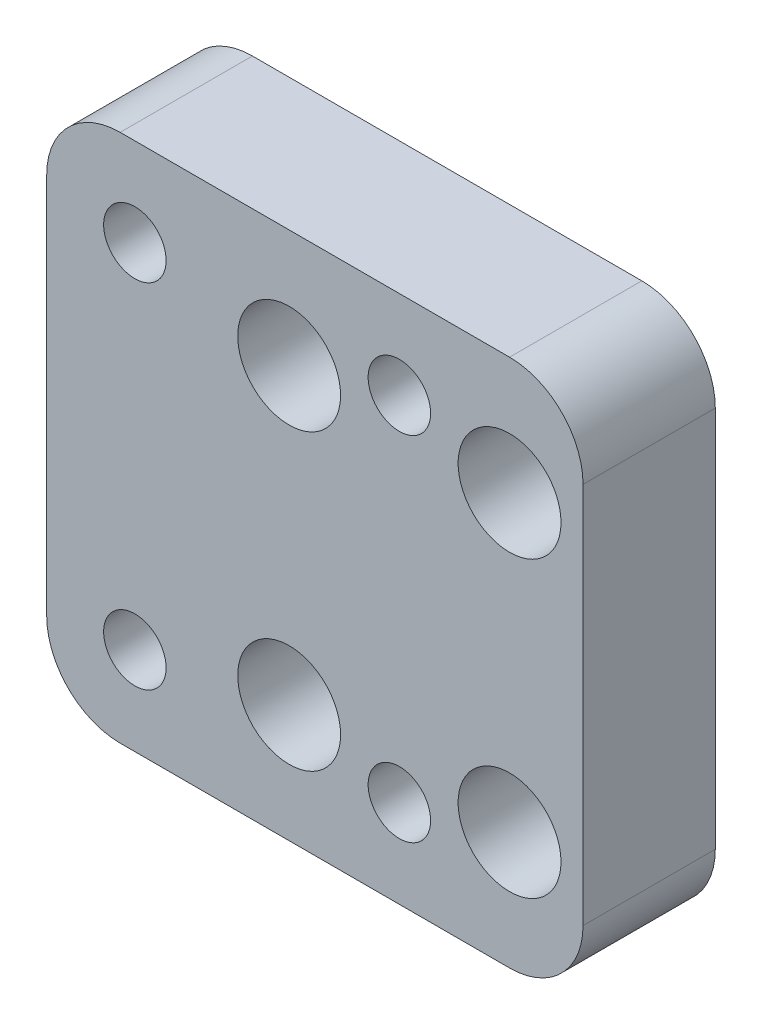
from build123d import *

# Parameters (mm, degrees)
SKETCH1_W           = 36.5
SKETCH1_H           = 36
SKETCH1_R           = 1.625
SKETCH1_R_2         = 2.125
BOSS_EXTRUDE1_DEPTH = 9
SKETCH2_R           = 3.5
CUT_EXTRUDE1_DEPTH  = 5
CUT_EXTRUDE2_DEPTH  = 5
FILLET2_R           = 5


with BuildPart() as part:
    # Sketch1 → Boss-Extrude1 (new body)
    with BuildSketch(Plane.XY):
        with Locations((1.75, 10)):
            Rectangle(SKETCH1_W, SKETCH1_H)
        with Locations((0, 20)):
            Circle(SKETCH1_R, mode=Mode.SUBTRACT)
        with Locations((15, 20)):
            Circle(SKETCH1_R, mode=Mode.SUBTRACT)
        with Locations((15, 0)):
            Circle(SKETCH1_R, mode=Mode.SUBTRACT)
        Circle(SKETCH1_R, mode=Mode.SUBTRACT)
        with Locations((-10.5, 22)):
            Circle(SKETCH1_R_2, mode=Mode.SUBTRACT)
        with Locations((7.5, 22)):
            Circle(SKETCH1_R_2, mode=Mode.SUBTRACT)
        with Locations((7.5, -2)):
            Circle(SKETCH1_R_2, mode=Mode.SUBTRACT)
        with Locations((-10.5, -2)):
            Circle(SKETCH1_R_2, mode=Mode.SUBTRACT)
    extrude(amount=BOSS_EXTRUDE1_DEPTH)

    # Sketch2 → Cut-Extrude1 (cut)
    with BuildSketch(Plane.XY.offset(9)):
        with Locations((0, 20)):
            Circle(SKETCH2_R)
        Circle(SKETCH2_R)
        with Locations((15, 0)):
            Circle(SKETCH2_R)
        with Locations((15, 20)):
            Circle(SKETCH2_R)
    extrude(amount=-CUT_EXTRUDE1_DEPTH, mode=Mode.SUBTRACT)

    # Sketch3 → Cut-Extrude2 (cut)
    with BuildSketch(Plane(origin=(0, 0, 0), x_dir=(-1, 0, 0), z_dir=(0, 0, -1))):
        Polygon((-5.334936491, 18.25), (-3.169872981, 22), (-5.334936491, 25.75), (-9.665063509, 25.75), (-11.830127019, 22), (-9.665063509, 18.25), align=None)
        Polygon((12.665063509, 18.25), (14.830127019, 22), (12.665063509, 25.75), (8.334936491, 25.75), (6.169872981, 22), (8.334936491, 18.25), align=None)
        Polygon((12.665063509, -5.75), (14.830127019, -2), (12.665063509, 1.75), (8.334936491, 1.75), (6.169872981, -2), (8.334936491, -5.75), align=None)
        Polygon((-9.665063509, -5.75), (-5.334936491, -5.75), (-3.169872981, -2), (-5.334936491, 1.75), (-9.665063509, 1.75), (-11.830127019, -2), align=None)
    extrude(amount=-CUT_EXTRUDE2_DEPTH, mode=Mode.SUBTRACT)

    # Fillet2
    fillet2_edges = [part.edges().sort_by_distance(p)[0] for p in [
        (-16.5, 28, 4.5),
        (20, 28, 4.5),
        (20, -8, 4.5),
        (-16.5, -8, 4.5),
    ]]
    fillet(fillet2_edges, radius=FILLET2_R)


solid = part.part
